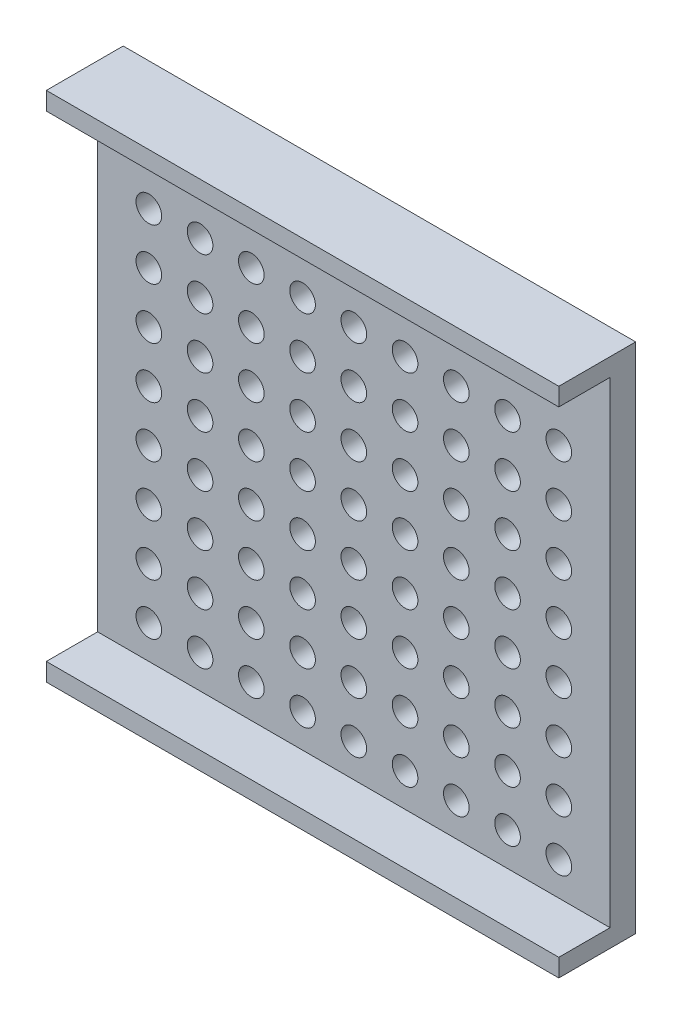
from build123d import *

# Parameters (mm, degrees)
SKETCH1_W           = 100
SKETCH1_H           = 100
SKETCH1_R           = 2.5
BOSS_EXTRUDE1_DEPTH = 5
SKETCH2_W           = 100
SKETCH2_H           = 3.5
BOSS_EXTRUDE2_DEPTH = 10


with BuildPart() as part:
    # Sketch1 → Boss-Extrude1 (new body)
    with BuildSketch(Plane.XY):
        Rectangle(SKETCH1_W, SKETCH1_H)
        with Locations((-40, 40)):
            Circle(SKETCH1_R, mode=Mode.SUBTRACT)
        with Locations((-30, 40)):
            Circle(SKETCH1_R, mode=Mode.SUBTRACT)
        with Locations((-20, 40)):
            Circle(SKETCH1_R, mode=Mode.SUBTRACT)
        with Locations((-10, 40)):
            Circle(SKETCH1_R, mode=Mode.SUBTRACT)
        with Locations((0, 40)):
            Circle(SKETCH1_R, mode=Mode.SUBTRACT)
        with Locations((10, 40)):
            Circle(SKETCH1_R, mode=Mode.SUBTRACT)
        with Locations((20, 40)):
            Circle(SKETCH1_R, mode=Mode.SUBTRACT)
        with Locations((30, 40)):
            Circle(SKETCH1_R, mode=Mode.SUBTRACT)
        with Locations((40, 40)):
            Circle(SKETCH1_R, mode=Mode.SUBTRACT)
        with Locations((-40, 30)):
            Circle(SKETCH1_R, mode=Mode.SUBTRACT)
        with Locations((-30, 30)):
            Circle(SKETCH1_R, mode=Mode.SUBTRACT)
        with Locations((-20, 30)):
            Circle(SKETCH1_R, mode=Mode.SUBTRACT)
        with Locations((-10, 30)):
            Circle(SKETCH1_R, mode=Mode.SUBTRACT)
        with Locations((0, 30)):
            Circle(SKETCH1_R, mode=Mode.SUBTRACT)
        with Locations((10, 30)):
            Circle(SKETCH1_R, mode=Mode.SUBTRACT)
        with Locations((20, 30)):
            Circle(SKETCH1_R, mode=Mode.SUBTRACT)
        with Locations((30, 30)):
            Circle(SKETCH1_R, mode=Mode.SUBTRACT)
        with Locations((40, 30)):
            Circle(SKETCH1_R, mode=Mode.SUBTRACT)
        with Locations((-40, 20)):
            Circle(SKETCH1_R, mode=Mode.SUBTRACT)
        with Locations((-30, 20)):
            Circle(SKETCH1_R, mode=Mode.SUBTRACT)
        with Locations((-20, 20)):
            Circle(SKETCH1_R, mode=Mode.SUBTRACT)
        with Locations((-10, 20)):
            Circle(SKETCH1_R, mode=Mode.SUBTRACT)
        with Locations((0, 20)):
            Circle(SKETCH1_R, mode=Mode.SUBTRACT)
        with Locations((10, 20)):
            Circle(SKETCH1_R, mode=Mode.SUBTRACT)
        with Locations((20, 20)):
            Circle(SKETCH1_R, mode=Mode.SUBTRACT)
        with Locations((30, 20)):
            Circle(SKETCH1_R, mode=Mode.SUBTRACT)
        with Locations((40, 20)):
            Circle(SKETCH1_R, mode=Mode.SUBTRACT)
        with Locations((-40, 10)):
            Circle(SKETCH1_R, mode=Mode.SUBTRACT)
        with Locations((-30, 10)):
            Circle(SKETCH1_R, mode=Mode.SUBTRACT)
        with Locations((-20, 10)):
            Circle(SKETCH1_R, mode=Mode.SUBTRACT)
        with Locations((-10, 10)):
            Circle(SKETCH1_R, mode=Mode.SUBTRACT)
        with Locations((0, 10)):
            Circle(SKETCH1_R, mode=Mode.SUBTRACT)
        with Locations((10, 10)):
            Circle(SKETCH1_R, mode=Mode.SUBTRACT)
        with Locations((20, 10)):
            Circle(SKETCH1_R, mode=Mode.SUBTRACT)
        with Locations((30, 10)):
            Circle(SKETCH1_R, mode=Mode.SUBTRACT)
        with Locations((40, 10)):
            Circle(SKETCH1_R, mode=Mode.SUBTRACT)
        with Locations((-40, 0)):
            Circle(SKETCH1_R, mode=Mode.SUBTRACT)
        with Locations((-30, 0)):
            Circle(SKETCH1_R, mode=Mode.SUBTRACT)
        with Locations((-20, 0)):
            Circle(SKETCH1_R, mode=Mode.SUBTRACT)
        with Locations((-10, 0)):
            Circle(SKETCH1_R, mode=Mode.SUBTRACT)
        Circle(SKETCH1_R, mode=Mode.SUBTRACT)
        with Locations((10, 0)):
            Circle(SKETCH1_R, mode=Mode.SUBTRACT)
        with Locations((20, 0)):
            Circle(SKETCH1_R, mode=Mode.SUBTRACT)
        with Locations((30, 0)):
            Circle(SKETCH1_R, mode=Mode.SUBTRACT)
        with Locations((40, 0)):
            Circle(SKETCH1_R, mode=Mode.SUBTRACT)
        with Locations((-40, -10)):
            Circle(SKETCH1_R, mode=Mode.SUBTRACT)
        with Locations((-30, -10)):
            Circle(SKETCH1_R, mode=Mode.SUBTRACT)
        with Locations((-20, -10)):
            Circle(SKETCH1_R, mode=Mode.SUBTRACT)
        with Locations((-10, -10)):
            Circle(SKETCH1_R, mode=Mode.SUBTRACT)
        with Locations((0, -10)):
            Circle(SKETCH1_R, mode=Mode.SUBTRACT)
        with Locations((10, -10)):
            Circle(SKETCH1_R, mode=Mode.SUBTRACT)
        with Locations((20, -10)):
            Circle(SKETCH1_R, mode=Mode.SUBTRACT)
        with Locations((30, -10)):
            Circle(SKETCH1_R, mode=Mode.SUBTRACT)
        with Locations((40, -10)):
            Circle(SKETCH1_R, mode=Mode.SUBTRACT)
        with Locations((-40, -20)):
            Circle(SKETCH1_R, mode=Mode.SUBTRACT)
        with Locations((-30, -20)):
            Circle(SKETCH1_R, mode=Mode.SUBTRACT)
        with Locations((-20, -20)):
            Circle(SKETCH1_R, mode=Mode.SUBTRACT)
        with Locations((-10, -20)):
            Circle(SKETCH1_R, mode=Mode.SUBTRACT)
        with Locations((0, -20)):
            Circle(SKETCH1_R, mode=Mode.SUBTRACT)
        with Locations((10, -20)):
            Circle(SKETCH1_R, mode=Mode.SUBTRACT)
        with Locations((20, -20)):
            Circle(SKETCH1_R, mode=Mode.SUBTRACT)
        with Locations((30, -20)):
            Circle(SKETCH1_R, mode=Mode.SUBTRACT)
        with Locations((40, -20)):
            Circle(SKETCH1_R, mode=Mode.SUBTRACT)
        with Locations((-40, -30)):
            Circle(SKETCH1_R, mode=Mode.SUBTRACT)
        with Locations((-30, -30)):
            Circle(SKETCH1_R, mode=Mode.SUBTRACT)
        with Locations((-20, -30)):
            Circle(SKETCH1_R, mode=Mode.SUBTRACT)
        with Locations((-10, -30)):
            Circle(SKETCH1_R, mode=Mode.SUBTRACT)
        with Locations((0, -30)):
            Circle(SKETCH1_R, mode=Mode.SUBTRACT)
        with Locations((10, -30)):
            Circle(SKETCH1_R, mode=Mode.SUBTRACT)
        with Locations((20, -30)):
            Circle(SKETCH1_R, mode=Mode.SUBTRACT)
        with Locations((30, -30)):
            Circle(SKETCH1_R, mode=Mode.SUBTRACT)
        with Locations((40, -30)):
            Circle(SKETCH1_R, mode=Mode.SUBTRACT)
        with Locations((-40, -40)):
            Circle(SKETCH1_R, mode=Mode.SUBTRACT)
        with Locations((-30, -40)):
            Circle(SKETCH1_R, mode=Mode.SUBTRACT)
        with Locations((-20, -40)):
            Circle(SKETCH1_R, mode=Mode.SUBTRACT)
        with Locations((-10, -40)):
            Circle(SKETCH1_R, mode=Mode.SUBTRACT)
        with Locations((0, -40)):
            Circle(SKETCH1_R, mode=Mode.SUBTRACT)
        with Locations((10, -40)):
            Circle(SKETCH1_R, mode=Mode.SUBTRACT)
        with Locations((20, -40)):
            Circle(SKETCH1_R, mode=Mode.SUBTRACT)
        with Locations((30, -40)):
            Circle(SKETCH1_R, mode=Mode.SUBTRACT)
        with Locations((40, -40)):
            Circle(SKETCH1_R, mode=Mode.SUBTRACT)
    extrude(amount=BOSS_EXTRUDE1_DEPTH)

    # Sketch2 → Boss-Extrude2 (add)
    with BuildSketch(Plane.XY.offset(5)):
        with Locations((0, 48.25)):
            Rectangle(SKETCH2_W, SKETCH2_H)
        with Locations((0, -48.25)):
            Rectangle(SKETCH2_W, SKETCH2_H)
    extrude(amount=BOSS_EXTRUDE2_DEPTH)


solid = part.part
